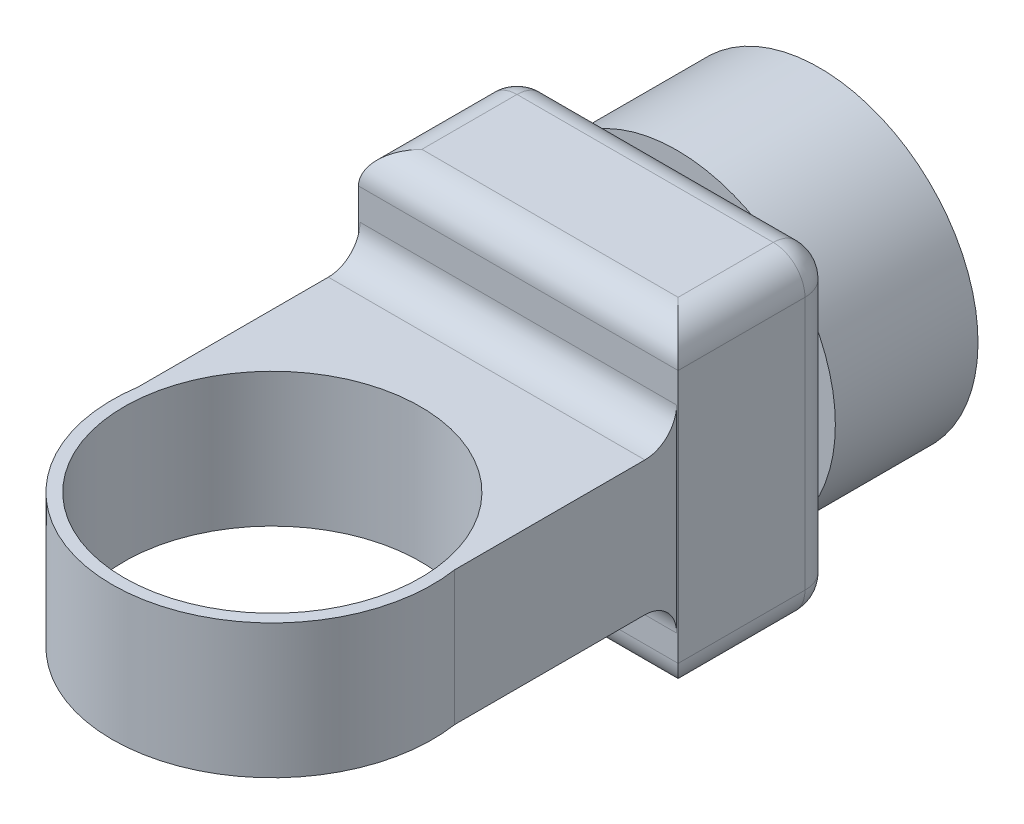
from build123d import *

# Parameters (mm, degrees)
SKETCH_1_R          = 50.5
SKETCH_1_R_2        = 46.75
EXTRUDE_1_DEPTH     = 42.3
EXTRUDE_3_DEPTH     = 42.3
SKETCH_10_W         = 100.829972986
SKETCH_10_H         = 100
EXTRUDE_6_DEPTH     = 50
FILLET_13_R         = 10
FILLET_14_R         = 10
SKETCH_11_R         = 50
EXTRUDE_7_DEPTH     = 45
SKETCH_12_R         = 46.5
CUT_EXTRUDE_1_DEPTH = 42.3


with BuildPart() as part:
    # 草图1 → 凸台-拉伸1 (new body)
    with BuildSketch(Plane(origin=(0, 0, 0), x_dir=(1, 0, 0), z_dir=(0, 1, 0))):
        with Locations(Location((0, 0, 0), (0, 0, 270))):
            Circle(SKETCH_1_R)
        with Locations(Location((0, 0, 0), (0, 0, 270))):
            Circle(SKETCH_1_R_2, mode=Mode.SUBTRACT)
    extrude(amount=EXTRUDE_1_DEPTH)

    # 草图2 → 凸台-拉伸3 (add)
    with BuildSketch(Plane(origin=(0, 42.3, 0), x_dir=(1, 0, 0), z_dir=(0, 1, 0))):
        with BuildLine():
            Line((-49.922748528, 77.584165112), (49.927251472, 77.584165112))
            Line((49.927251472, 77.584165112), (49.927251472, 7.584165112))
            ThreePointArc((49.927251472, 7.584165112), (0.002251472, 49.671200662), (-49.922748528, 7.584165112))
            Line((-49.922748528, 7.584165112), (-49.922748528, 77.584165112))
        make_face()
    extrude(amount=-EXTRUDE_3_DEPTH)

    # 草图10 → 凸台-拉伸6 (add)
    with BuildSketch(Plane(origin=(0, 0, -77.584165112), x_dir=(-1, 0, 0), z_dir=(0, 0, -1))):
        with Locations((0, 21.964414078)):
            Rectangle(SKETCH_10_W, SKETCH_10_H)
    extrude(amount=EXTRUDE_6_DEPTH)

    # 圆角13
    fillet_13_edges = [part.edges().sort_by_distance(p)[0] for p in [
        (0.002251472, 0, -77.584165112),
        (0.002251472, 42.3, -77.584165112),
    ]]
    fillet(fillet_13_edges, radius=FILLET_13_R)

    # 圆角14
    fillet_14_edges = [part.edges().sort_by_distance(p)[0] for p in [
        (-50.414986493, -28.035585922, -102.584165112),
        (0, 71.964414078, -77.584165112),
        (-50.414986493, 71.964414078, -102.584165112),
        (50.414986493, 71.964414078, -102.584165112),
        (0, -28.035585922, -77.584165112),
        (50.414986493, -28.035585922, -102.584165112),
        (-50.414986493, 21.964414078, -127.584165112),
        (0, 71.964414078, -127.584165112),
        (50.414986493, 21.964414078, -127.584165112),
        (0, -28.035585922, -127.584165112),
    ]]
    fillet(fillet_14_edges, radius=FILLET_14_R)

    # 草图11 → 凸台-拉伸7 (add)
    with BuildSketch(Plane(origin=(0, 0, -127.584165112), x_dir=(-1, 0, 0), z_dir=(0, 0, -1))):
        with Locations(Location((0, 21.964414078, 0), (0, 0, 143.930141518))):
            Circle(SKETCH_11_R)
    extrude(amount=EXTRUDE_7_DEPTH)

    # 草图12 → 切除-拉伸1 (cut)
    with BuildSketch(Plane(origin=(0, 0, -172.584165112), x_dir=(-1, 0, 0), z_dir=(0, 0, -1))):
        with Locations((0, 21.964414078)):
            Circle(SKETCH_12_R)
    extrude(amount=-CUT_EXTRUDE_1_DEPTH, mode=Mode.SUBTRACT)


solid = part.part
